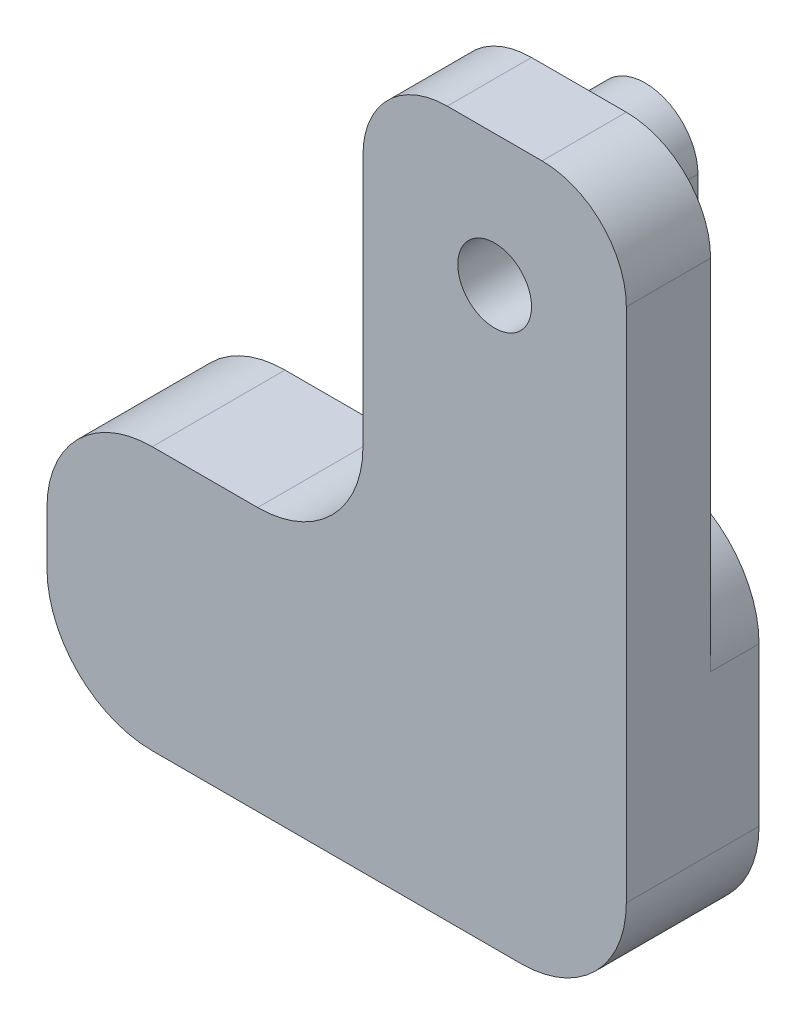
from build123d import *

# Parameters (mm, degrees)
BOSS_EXTRUDE1_DEPTH = 6.3
BOSS_EXTRUDE2_DEPTH = 8
SKETCH3_R           = 3.5
CUT_EXTRUDE1_DEPTH  = 8
BOSS_EXTRUDE3_START = -8
BOSS_EXTRUDE3_DEPTH = 8
SKETCH5_W           = 30
SKETCH5_H           = 25
BOSS_EXTRUDE4_DEPTH = 8
FILLET1_R           = 10
BOSS_EXTRUDE5_START = 4.6
BOSS_EXTRUDE5_DEPTH = 4.6


with BuildPart() as part:
    # Sketch1 → Boss-Extrude1 (new body)
    with BuildSketch(Plane.XY):
        with BuildLine():
            Line((5, 4.5), (5, -4.5))
            ThreePointArc((5, -4.5), (0, -9.5), (-5, -4.5))
            Line((-5, -4.5), (-5, 4.5))
            ThreePointArc((-5, 4.5), (0, 9.5), (5, 4.5))
        make_face()
    extrude(amount=BOSS_EXTRUDE1_DEPTH)

    # Sketch2 → Boss-Extrude2 (add)
    with BuildSketch(Plane.XY.offset(6.3)):
        with BuildLine():
            Line((-4.5, 12.5), (4.5, 12.5))
            ThreePointArc((4.5, 12.5), (10.156854249, 10.156854249), (12.5, 4.5))
            Line((12.5, 4.5), (12.5, -4.5))
            ThreePointArc((12.5, -4.5), (10.156854249, -10.156854249), (4.5, -12.5))
            Line((4.5, -12.5), (-4.5, -12.5))
            ThreePointArc((-4.5, -12.5), (-10.156854249, -10.156854249), (-12.5, -4.5))
            Line((-12.5, -4.5), (-12.5, 4.5))
            ThreePointArc((-12.5, 4.5), (-10.156854249, 10.156854249), (-4.5, 12.5))
        make_face()
    extrude(amount=BOSS_EXTRUDE2_DEPTH)

    # Sketch3 → Cut-Extrude1 (cut)
    with BuildSketch(Plane.XY.offset(14.3)):
        Circle(SKETCH3_R)
    extrude(amount=-CUT_EXTRUDE1_DEPTH, mode=Mode.SUBTRACT)

    # Sketch4 → Boss-Extrude3 (add)
    with BuildSketch(Plane.XY.offset(14.3).offset(BOSS_EXTRUDE3_START)):
        with BuildLine():
            Line((-12.5, -4.5), (-12.5, -54.5))
            Line((-12.5, -54.5), (12.5, -54.5))
            Line((12.5, -54.5), (12.5, -4.5))
            ThreePointArc((12.5, -4.5), (10.156854249, -10.156854249), (4.5, -12.5))
            Line((4.5, -12.5), (-4.5, -12.5))
            ThreePointArc((-4.5, -12.5), (-10.156854249, -10.156854249), (-12.5, -4.5))
        make_face()
    extrude(amount=BOSS_EXTRUDE3_DEPTH)

    # Sketch5 → Boss-Extrude4 (add)
    with BuildSketch(Plane.XY.offset(14.3)):
        with Locations((-27.5, -42)):
            Rectangle(SKETCH5_W, SKETCH5_H)
    extrude(amount=-BOSS_EXTRUDE4_DEPTH)

    # Fillet1
    fillet1_edges = [part.edges().sort_by_distance(p)[0] for p in [
        (12.5, -54.5, 10.3),
        (-12.5, -29.5, 10.3),
        (-42.5, -54.5, 10.3),
        (-42.5, -29.5, 10.3),
    ]]
    fillet(fillet1_edges, radius=FILLET1_R)

    # Sketch6 → Boss-Extrude5 (add)
    with BuildSketch(Plane(origin=(0, 0, 6.3), x_dir=(-1, 0, 0), z_dir=(0, 0, -1)).offset(BOSS_EXTRUDE5_START)):
        with BuildLine():
            Line((-2.5, -19.5), (5.179491924, -19.5))
            ThreePointArc((5.179491924, -19.5), (10.179491924, -20.839745962), (13.839745962, -24.5))
            ThreePointArc((13.839745962, -24.5), (17.5, -28.160254038), (22.5, -29.5))
            Line((22.5, -29.5), (32.5, -29.5))
            ThreePointArc((32.5, -29.5), (39.571067812, -32.428932188), (42.5, -39.5))
            Line((42.5, -39.5), (42.5, -44.5))
            ThreePointArc((42.5, -44.5), (39.571067812, -51.571067812), (32.5, -54.5))
            Line((32.5, -54.5), (-2.5, -54.5))
            ThreePointArc((-2.5, -54.5), (-9.571067812, -51.571067812), (-12.5, -44.5))
            Line((-12.5, -44.5), (-12.5, -29.5))
            ThreePointArc((-12.5, -29.5), (-9.571067812, -22.428932188), (-2.5, -19.5))
        make_face()
    extrude(amount=-BOSS_EXTRUDE5_DEPTH)


solid = part.part
